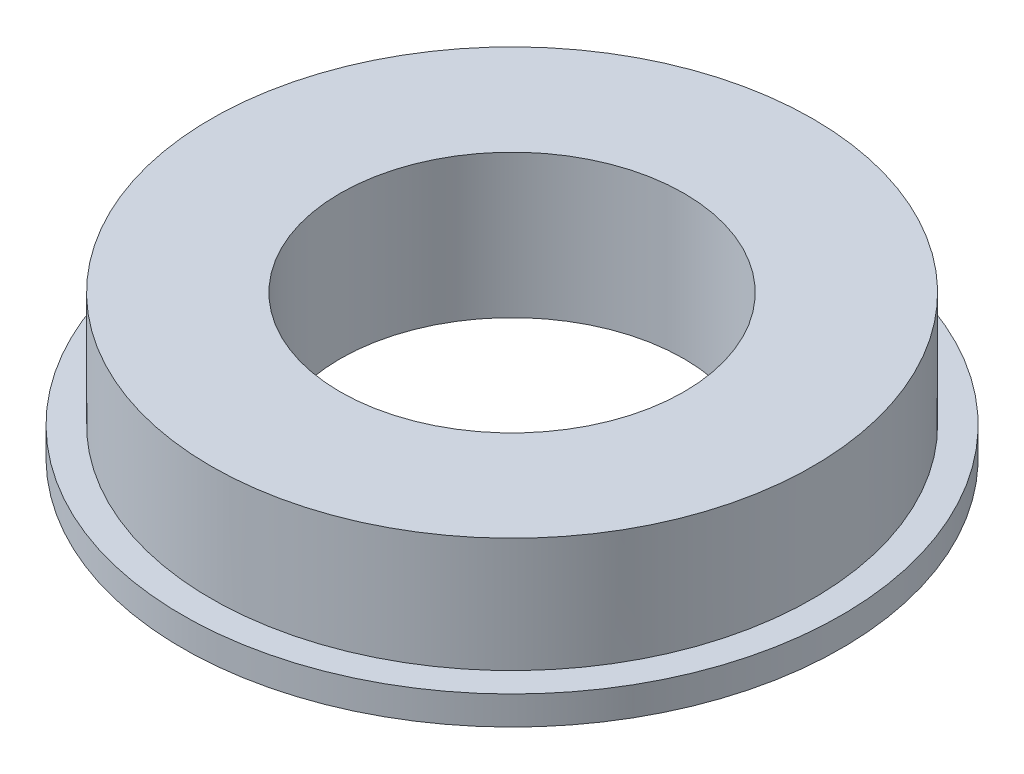
from build123d import *

# Parameters (mm, degrees)
SKETCH_1_R      = 10.5
SKETCH_1_R_2    = 6
EXTRUDE_1_DEPTH = 5
SKETCH_2_R      = 11.5
SKETCH_2_R_2    = 10.5
EXTRUDE_2_DEPTH = 1


with BuildPart() as part:
    # 草图1 → 凸台-拉伸1 (new body)
    with BuildSketch(Plane(origin=(0, 0, 0), x_dir=(1, 0, 0), z_dir=(0, 1, 0))):
        with Locations(Location((0, 0, 0), (0, 0, 270))):
            Circle(SKETCH_1_R)
        with Locations(Location((0, 0, 0), (0, 0, 270))):
            Circle(SKETCH_1_R_2, mode=Mode.SUBTRACT)
    extrude(amount=EXTRUDE_1_DEPTH)

    # 草图2 → 凸台-拉伸2 (add)
    with BuildSketch(Plane.XZ):
        with Locations(Location((0, 0, 0), (0, 0, 270))):
            Circle(SKETCH_2_R)
        with Locations(Location((0, 0, 0), (0, 0, 270))):
            Circle(SKETCH_2_R_2, mode=Mode.SUBTRACT)
    extrude(amount=-EXTRUDE_2_DEPTH)


solid = part.part
